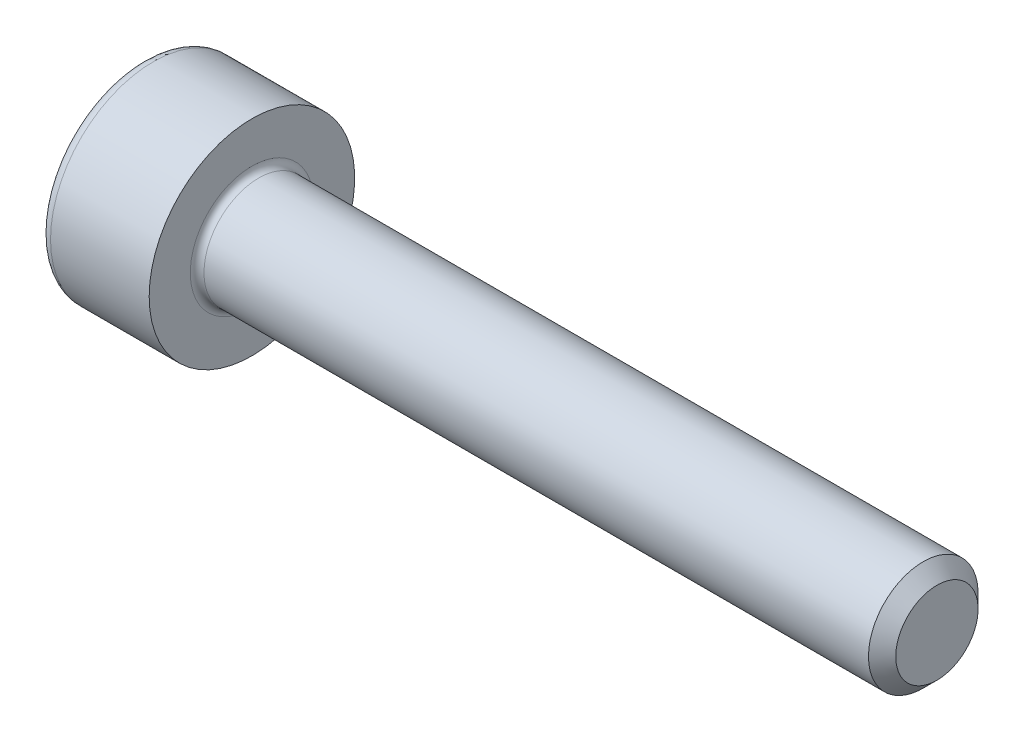
from build123d import *

# Parameters (mm, degrees)
FILLET1_R   = 0.1
FILLET2_R   = 0.16
HEX_2_DEPTH = 0.7


with BuildPart() as part:
    # BodySke → Base-Revolve (revolve)
    with BuildSketch(Plane.XY, mode=Mode.PRIVATE) as base_revolve_sk:
        Polygon((0, 0), (0, 1.5), (1.6, 1.5), (1.6, 0.8), (11.401, 0.8), (11.6, 0.601), (11.6, 0), align=None)
    revolve(base_revolve_sk.sketch.rotate(Axis((-31.75, 0, 0), (1, 0, 0)), 90), axis=Axis((-31.75, 0, 0), (1, 0, 0)))

    # Fillet1
    fillet1_edges = [part.edges().sort_by_distance(p)[0] for p in [
        (1.6, 0, -0.8),
    ]]
    fillet(fillet1_edges, radius=FILLET1_R)

    # Fillet2
    fillet2_edges = [part.edges().sort_by_distance(p)[0] for p in [
        (0, 0, -1.5),
    ]]
    fillet(fillet2_edges, radius=FILLET2_R)

    # Sketch2 → Hex-PreBroach (revolve, cut)
    with BuildSketch(Plane.XY, mode=Mode.PRIVATE) as hex_prebroach_sk:
        Polygon((0, 0.76), (0.7, 0.76), (1.138786205, 0), (0, 0), align=None)
    revolve(hex_prebroach_sk.sketch.rotate(Axis((0, 0, 0), (1, 0, 0)), 90), axis=Axis((0, 0, 0), (1, 0, 0)), mode=Mode.SUBTRACT)

    # Sketch3 → Hex 2 (cut)
    with BuildSketch(Plane(origin=(0, 0, 0), x_dir=(0, 0.500000000000001, 0.866025403784438), z_dir=(-1, 0, 0))):
        Polygon((0.438786205, 0.76), (-0.438786205, 0.76), (-0.877572409, 0), (-0.438786205, -0.76), (0.438786205, -0.76), (0.877572409, 0), align=None)
    extrude(amount=-HEX_2_DEPTH, mode=Mode.SUBTRACT)


solid = part.part
